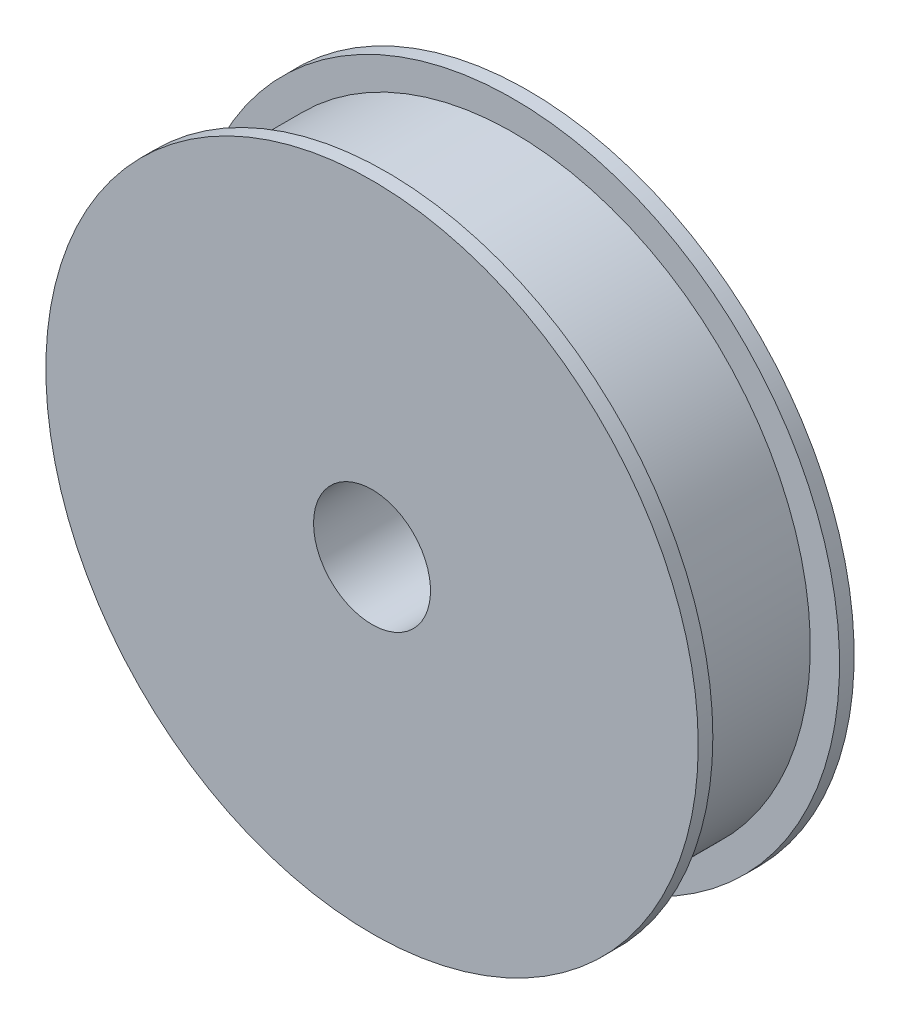
from build123d import *

# Parameters (mm, degrees)
SKETCH_1_R          = 30.47
EXTRUDE_1_DEPTH     = 13
SKETCH_2_R          = 33.47
EXTRUDE_2_DEPTH     = 1.5
EXTRUDE_START       = 1.5
SKETCH_3_R          = 33.47
EXTRUDE_3_DEPTH     = 1.5
SKETCH_4_R          = 6
CUT_EXTRUDE_1_DEPTH = 50.964805614
SKETCH_5_R          = 10
CUT_EXTRUDE_2_DEPTH = 5


with BuildPart() as part:
    # 草图1 → 凸台-拉伸1 (new body)
    with BuildSketch(Plane.XY):
        with Locations(Location((0, 0, 0), (0, 0, 180))):
            Circle(SKETCH_1_R)
    extrude(amount=EXTRUDE_1_DEPTH)

    # 草图2 → 凸台-拉伸2 (add)
    with BuildSketch(Plane.XY.offset(13)):
        Circle(SKETCH_2_R)
    extrude(amount=EXTRUDE_2_DEPTH)

    # 草图3 → 凸台-拉伸3 (add)
    with BuildSketch(Plane(origin=(0, 0, 0), x_dir=(-1, 0, 0), z_dir=(0, 0, -1)).offset(EXTRUDE_START)):
        with Locations(Location((0, 0, 0), (0, 0, 180))):
            Circle(SKETCH_3_R)
    extrude(amount=-EXTRUDE_3_DEPTH)

    # 草图4 → 切除-拉伸1 (cut, through all)
    with BuildSketch(Plane(origin=(0, 0, -1.5), x_dir=(-1, 0, 0), z_dir=(0, 0, -1))):
        Circle(SKETCH_4_R)
    extrude(amount=-CUT_EXTRUDE_1_DEPTH, mode=Mode.SUBTRACT)

    # 草图5 → 切除-拉伸2 (cut)
    with BuildSketch(Plane(origin=(0, 0, -1.5), x_dir=(-1, 0, 0), z_dir=(0, 0, -1))):
        Circle(SKETCH_5_R)
    extrude(amount=-CUT_EXTRUDE_2_DEPTH, mode=Mode.SUBTRACT)


solid = part.part
